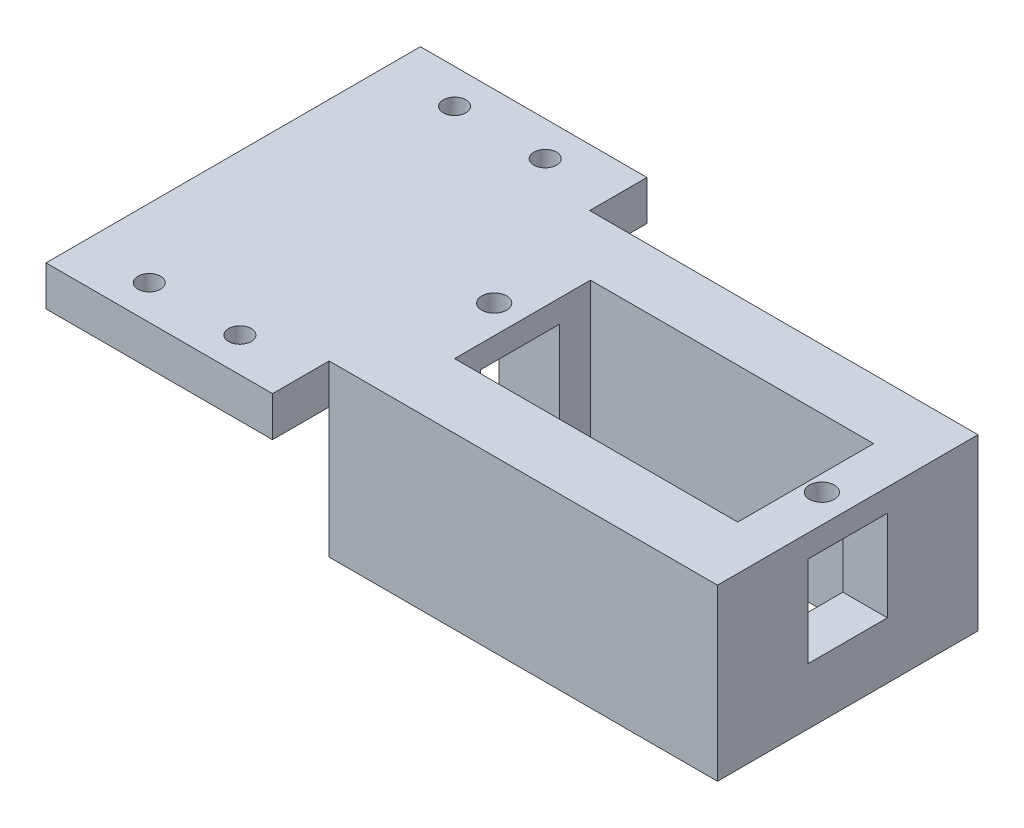
from build123d import *

# Parameters (mm, degrees)
ESQUISSE1_W             = 34.285714285
ESQUISSE1_H             = 23
ESQUISSE1_W_2           = 25
ESQUISSE1_H_2           = 12
BOSS_EXTRU_1_DEPTH      = 15
ESQUISSE2_W             = 7
ESQUISSE2_H             = 8
ENL_V_MAT_EXTRU_1_DEPTH = 60
ESQUISSE3_R             = 1.1
ENL_V_MAT_EXTRU_2_DEPTH = 10
ESQUISSE4_W             = 7
ESQUISSE4_H             = 8
BOSS_EXTRU_2_DEPTH      = 20
ESQUISSE7_W             = 23
ESQUISSE7_H             = 11.477873567
ENL_V_MAT_EXTRU_3_DEPTH = 20
ESQUISSE6_R             = 1
ENL_V_MAT_EXTRU_4_DEPTH = 20


with BuildPart() as part:
    # Esquisse1 → Boss.-Extru.1 (new body)
    with BuildSketch(Plane(origin=(0, 0, 0), x_dir=(1, 0, 0), z_dir=(0, 1, 0))):
        with Locations((5.428571429, 1.035714286)):
            Rectangle(ESQUISSE1_W, ESQUISSE1_H)
        with Locations((6.142857143, 1.25)):
            Rectangle(ESQUISSE1_W_2, ESQUISSE1_H_2, mode=Mode.SUBTRACT)
    extrude(amount=BOSS_EXTRU_1_DEPTH)

    # Esquisse2 → Enlèv. mat.-Extru.1 (cut)
    with BuildSketch(Plane.ZY.offset(11.714285714)):
        with Locations((-1.035714286, 9)):
            Rectangle(ESQUISSE2_W, ESQUISSE2_H)
    extrude(amount=-ENL_V_MAT_EXTRU_1_DEPTH, mode=Mode.SUBTRACT)

    # Esquisse3 → Enlèv. mat.-Extru.2 (cut)
    with BuildSketch(Plane(origin=(0, 15, 0), x_dir=(1, 0, 0), z_dir=(0, 1, 0))):
        with Locations(Location((-8.857142857, 1.25, 0), (0, 0, 270))):
            Circle(ESQUISSE3_R)
        with Locations(Location((20.071428571, 1.25, 0), (0, 0, 270))):
            Circle(ESQUISSE3_R)
    extrude(amount=-ENL_V_MAT_EXTRU_2_DEPTH, mode=Mode.SUBTRACT)

    # Esquisse4 → Boss.-Extru.2 (add)
    with BuildSketch(Plane.ZY.offset(11.714285714)):
        Polygon((-12.535714286, 11.477873567), (-12.535714286, 0), (10.464285714, 0), (10.464285714, 11.477873567), (15.464285714, 11.477873567), (15.464285714, 15), (-17.595238813, 15), (-17.595238813, 11.477873567), align=None)
        with Locations((-1.035714286, 9)):
            Rectangle(ESQUISSE4_W, ESQUISSE4_H, mode=Mode.SUBTRACT)
    extrude(amount=BOSS_EXTRU_2_DEPTH)

    # Esquisse7 → Enlèv. mat.-Extru.3 (cut)
    with BuildSketch(Plane.ZY.offset(31.714285714)):
        with Locations((-1.035714286, 5.738936784)):
            Rectangle(ESQUISSE7_W, ESQUISSE7_H)
    extrude(amount=-ENL_V_MAT_EXTRU_3_DEPTH, mode=Mode.SUBTRACT)

    # Esquisse6 → Enlèv. mat.-Extru.4 (cut)
    with BuildSketch(Plane(origin=(0, 15, 0), x_dir=(1, 0, 0), z_dir=(0, 1, 0))):
        with Locations(Location((-25.64568933, 14.541881164, 0), (0, 0, 270))):
            Circle(ESQUISSE6_R)
        with Locations(Location((-17.64568933, 14.541881164, 0), (0, 0, 270))):
            Circle(ESQUISSE6_R)
        with Locations(Location((-25.636053252, -12.423788749, 0), (0, 0, 270))):
            Circle(ESQUISSE6_R)
        with Locations(Location((-17.636053252, -12.423788749, 0), (0, 0, 270))):
            Circle(ESQUISSE6_R)
    extrude(amount=-ENL_V_MAT_EXTRU_4_DEPTH, mode=Mode.SUBTRACT)


solid = part.part
